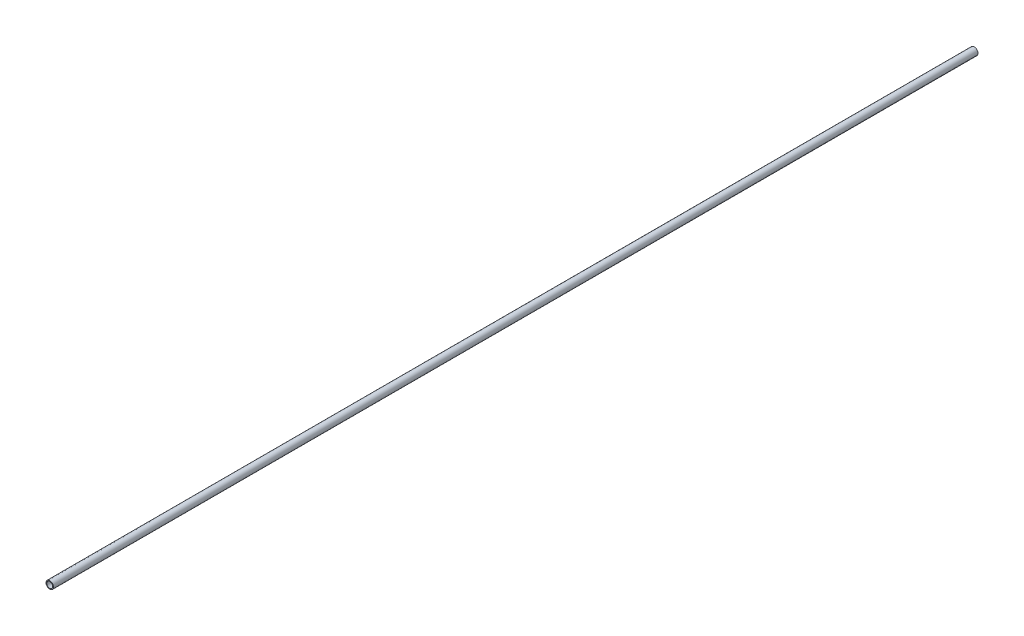
from build123d import *

# Parameters (mm, degrees)
SKETCH_1_R      = 5
SKETCH_1_R_2    = 4
EXTRUDE_1_DEPTH = 1233


with BuildPart() as part:
    # 草图1 → 凸台-拉伸1 (new body)
    with BuildSketch(Plane.XY):
        Circle(SKETCH_1_R)
        Circle(SKETCH_1_R_2, mode=Mode.SUBTRACT)
    extrude(amount=EXTRUDE_1_DEPTH)


solid = part.part
